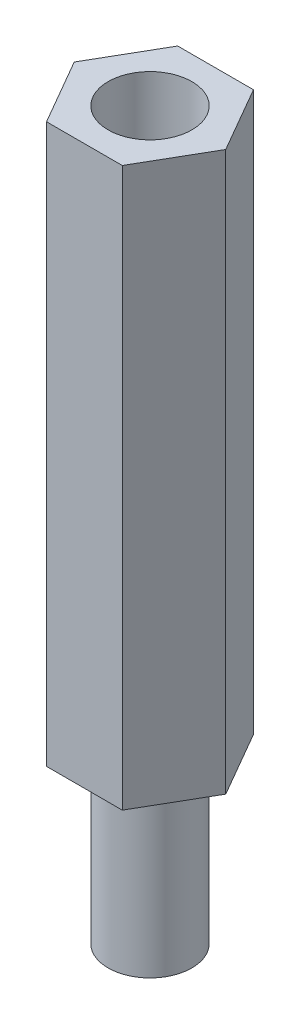
from build123d import *

# Parameters (mm, degrees)
SKETCH_1_R          = 1.5
EXTRUDE_1_DEPTH     = 20
SKETCH1_R           = 1.5
BOSS_EXTRUDE1_DEPTH = 6


with BuildPart() as part:
    # 草图1 → 凸台-拉伸1 (new body)
    with BuildSketch(Plane(origin=(0, 0, 0), x_dir=(1, 0, 0), z_dir=(0, 1, 0))):
        Polygon((2.713546265, 0), (1.356773133, 2.35), (-1.356773133, 2.35), (-2.713546265, 0), (-1.356773133, -2.35), (1.356773133, -2.35), align=None)
        with Locations(Location((0, 0, 0), (0, 0, 270))):
            Circle(SKETCH_1_R, mode=Mode.SUBTRACT)
    extrude(amount=EXTRUDE_1_DEPTH)


with BuildPart() as body_2:
    # Sketch1 → Boss-Extrude1 (new body)
    with BuildSketch(Plane.XZ):
        with Locations(Location((0, 0, 0), (0, 0, 270))):
            Circle(SKETCH1_R)
    extrude(amount=BOSS_EXTRUDE1_DEPTH)


solid = Compound([part.part, body_2.part])
